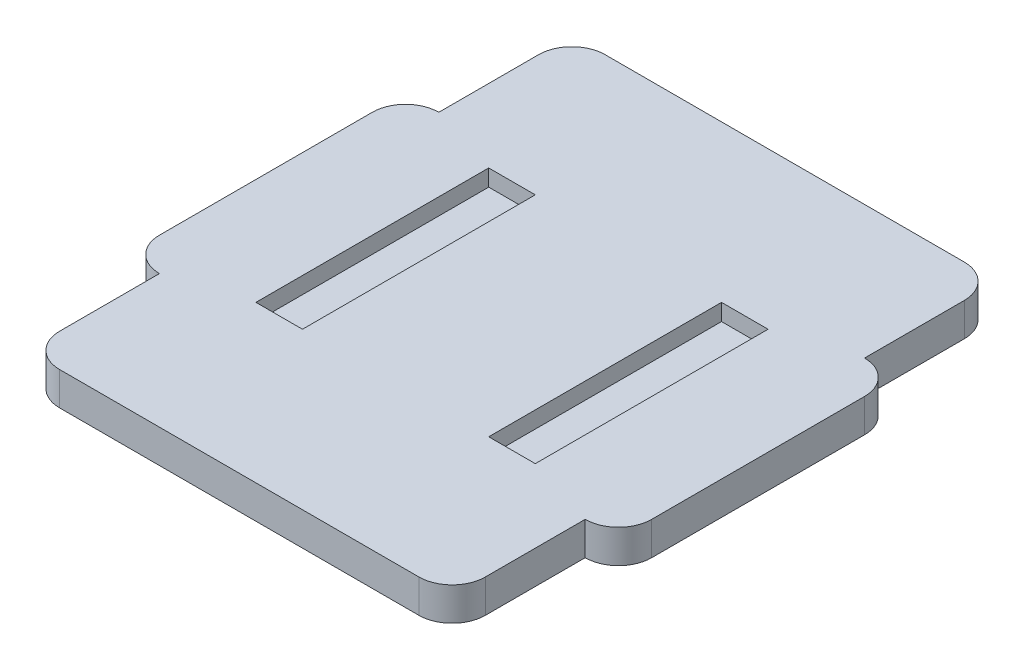
from build123d import *

# Parameters (mm, degrees)
SKETCH2_W           = 7
SKETCH2_H           = 35
BOSS_EXTRUDE1_DEPTH = 5
SKETCH2_3_W         = 7
SKETCH2_3_H         = 35
BOSS_EXTRUDE2_DEPTH = 2.5


with BuildPart() as part:
    # Sketch2 → Boss-Extrude1 (new body)
    with BuildSketch(Plane(origin=(0, 0, 0), x_dir=(1, 0, 0), z_dir=(0, 1, 0))):
        with BuildLine():
            Line((-18, 57), (-18, 42))
            ThreePointArc((-18, 42), (-21.535533906, 40.535533906), (-23, 37))
            Line((-23, 37), (-23, 5))
            ThreePointArc((-23, 5), (-21.535533906, 1.464466094), (-18, 0))
            Line((-18, 0), (-18, -15))
            ThreePointArc((-18, -15), (-16.535533906, -18.535533906), (-13, -20))
            Line((-13, -20), (41, -20))
            ThreePointArc((41, -20), (44.535533906, -18.535533906), (46, -15))
            Line((46, -15), (46, 0))
            ThreePointArc((46, 0), (49.535533906, 1.464466094), (51, 5))
            Line((51, 5), (51, 37))
            ThreePointArc((51, 37), (49.535533906, 40.535533906), (46, 42))
            Line((46, 42), (46, 57))
            ThreePointArc((46, 57), (44.535533906, 60.535533906), (41, 62))
            Line((41, 62), (-13, 62))
            ThreePointArc((-13, 62), (-16.535533906, 60.535533906), (-18, 57))
        make_face()
        with Locations((-3.5, 21)):
            Rectangle(SKETCH2_W, SKETCH2_H, mode=Mode.SUBTRACT)
        with Locations((31.5, 21)):
            Rectangle(SKETCH2_W, SKETCH2_H, mode=Mode.SUBTRACT)
    extrude(amount=BOSS_EXTRUDE1_DEPTH)

    # Sketch2<3> → Boss-Extrude2 (add)
    with BuildSketch(Plane(origin=(0, 0, 0), x_dir=(1, 0, 0), z_dir=(0, 1, 0))):
        with Locations((-3.5, 21)):
            Rectangle(SKETCH2_3_W, SKETCH2_3_H)
        with Locations((31.5, 21)):
            Rectangle(SKETCH2_3_W, SKETCH2_3_H)
    extrude(amount=BOSS_EXTRUDE2_DEPTH)


solid = part.part
